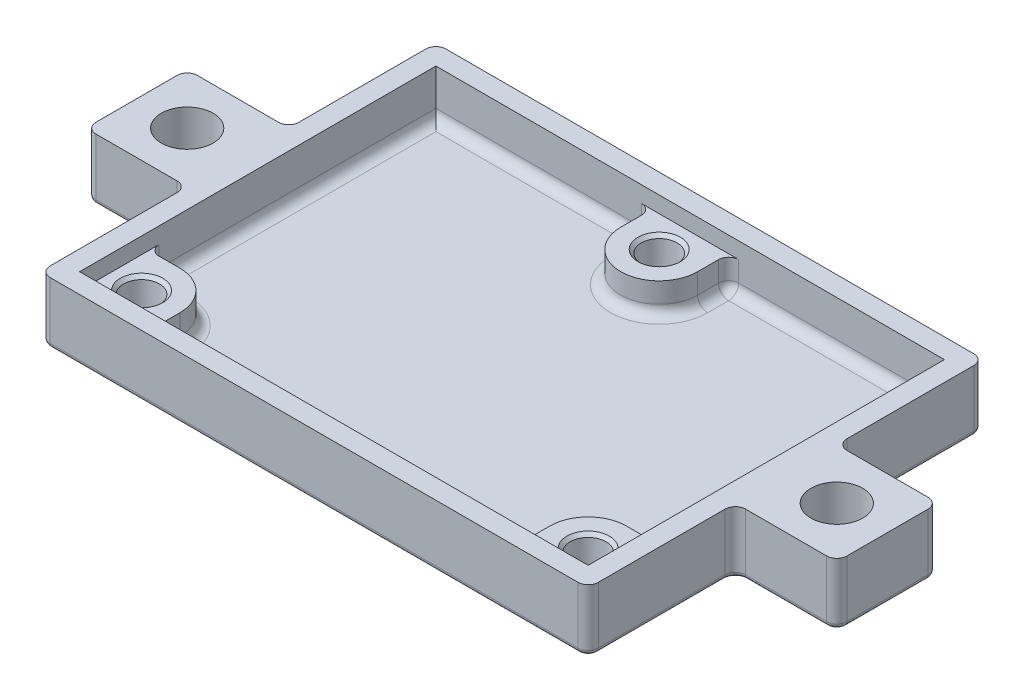
from build123d import *
from OCP.BRepFilletAPI import BRepFilletAPI_MakeChamfer

# Parameters (mm, degrees)
SKETCH1_W           = 54
SKETCH1_H           = 39
SKETCH1_W_2         = 10
SKETCH1_H_2         = 10
SKETCH1_R           = 2.5527
BOSS_EXTRUDE1_DEPTH = 6.1
SKETCH2_W           = 50.1
SKETCH2_H           = 35.1
CUT_EXTRUDE1_DEPTH  = 1.6
CUT_EXTRUDE2_DEPTH  = 3
SKETCH4_R           = 1.56
CUT_EXTRUDE3_DEPTH  = 43.065425233
SKETCH5_R           = 1.79
CUT_EXTRUDE4_DEPTH  = 2.92
DRAFT2_ANGLE        = 4
DRAFT3_ANGLE        = 4
DRAFT4_ANGLE        = 4
FILLET1_R           = 1
FILLET2_R           = 1
FILLET3_R           = 0.5
CHAMFER1_SIZE       = 0.3
CHAMFER1_SIZE2      = 0.323342908


with BuildPart() as part:
    # Sketch1 → Boss-Extrude1 (new body)
    # profile 1 of 3: a face of its own
    with BuildSketch(Plane(origin=(0, 0, 0), x_dir=(1, 0, 0), z_dir=(0, 1, 0))):
        Rectangle(SKETCH1_W, SKETCH1_H)
    # profile 2 of 3: a face of its own
    with BuildSketch(Plane(origin=(0, 0, 0), x_dir=(1, 0, 0), z_dir=(0, 1, 0))):
        with Locations((32, 0)):
            Rectangle(SKETCH1_W_2, SKETCH1_H_2)
        with Locations(Location((32, 0, 0), (0, 0, 270))):
            Circle(SKETCH1_R, mode=Mode.SUBTRACT)
    # profile 3 of 3: a face of its own
    with BuildSketch(Plane(origin=(0, 0, 0), x_dir=(1, 0, 0), z_dir=(0, 1, 0))):
        with Locations((-32, 0)):
            Rectangle(SKETCH1_W_2, SKETCH1_H_2)
        with Locations(Location((-32, 0, 0), (0, 0, 270))):
            Circle(SKETCH1_R, mode=Mode.SUBTRACT)
    extrude(amount=BOSS_EXTRUDE1_DEPTH)

    # Sketch2 → Cut-Extrude1 (cut)
    with BuildSketch(Plane(origin=(0, 6.1, 0), x_dir=(1, 0, 0), z_dir=(0, 1, 0))):
        Rectangle(SKETCH2_W, SKETCH2_H)
    extrude(amount=-CUT_EXTRUDE1_DEPTH, mode=Mode.SUBTRACT)

    # Sketch3 → Cut-Extrude2 (cut)
    with BuildSketch(Plane(origin=(0, 4.5, 0), x_dir=(1, 0, 0), z_dir=(0, 1, 0))):
        with BuildLine():
            Line((-3.79, 14.5), (-3.79, 17.55))
            Line((-3.79, 17.55), (-25.05, 17.55))
            Line((-25.05, 17.55), (-25.05, -10.71))
            Line((-25.05, -10.71), (-22, -10.71))
            ThreePointArc((-22, -10.71), (-19.320065299, -11.820065299), (-18.21, -14.5))
            Line((-18.21, -14.5), (-18.21, -17.55))
            Line((-18.21, -17.55), (18.21, -17.55))
            Line((18.21, -17.55), (18.21, -14.5))
            ThreePointArc((18.21, -14.5), (19.320065299, -11.820065299), (22, -10.71))
            Line((22, -10.71), (25.05, -10.71))
            Line((25.05, -10.71), (25.05, 17.55))
            Line((25.05, 17.55), (3.79, 17.55))
            Line((3.79, 17.55), (3.79, 14.5))
            ThreePointArc((3.79, 14.5), (0, 10.71), (-3.79, 14.5))
        make_face()
    extrude(amount=-CUT_EXTRUDE2_DEPTH, mode=Mode.SUBTRACT)

    # Sketch4 → Cut-Extrude3 (cut, through all)
    with BuildSketch(Plane(origin=(0, 4.5, 0), x_dir=(1, 0, 0), z_dir=(0, 1, 0))):
        with Locations(Location((0, 14.5, 0), (0, 0, 270))):
            Circle(SKETCH4_R)
        with Locations(Location((-22, -14.5, 0), (0, 0, 270))):
            Circle(SKETCH4_R)
        with Locations(Location((22, -14.5, 0), (0, 0, 90))):
            Circle(SKETCH4_R)
    extrude(amount=-CUT_EXTRUDE3_DEPTH, mode=Mode.SUBTRACT)

    # Sketch5 → Cut-Extrude4 (cut)
    with BuildSketch(Plane(origin=(0, 4.5, 0), x_dir=(1, 0, 0), z_dir=(0, 1, 0))):
        with Locations(Location((0, 14.5, 0), (0, 0, 270))):
            Circle(SKETCH5_R)
        with Locations(Location((-22, -14.5, 0), (0, 0, 270))):
            Circle(SKETCH5_R)
        with Locations(Location((22, -14.5, 0), (0, 0, 90))):
            Circle(SKETCH5_R)
    extrude(amount=-CUT_EXTRUDE4_DEPTH, mode=Mode.SUBTRACT)

    # Draft2
    draft2_faces = [part.faces().sort_by_distance(p)[0] for p in [
        (0, 3.04, -16.29),
    ]]
    draft(draft2_faces, Plane.ZX.offset(4.5), DRAFT2_ANGLE)

    # Draft3
    draft3_faces = [part.faces().sort_by_distance(p)[0] for p in [
        (-22, 3.04, 12.71),
    ]]
    draft(draft3_faces, Plane.ZX.offset(4.5), DRAFT3_ANGLE)

    # Draft4
    draft4_faces = [part.faces().sort_by_distance(p)[0] for p in [
        (22, 3.04, 16.29),
    ]]
    draft(draft4_faces, Plane.ZX.offset(4.5), DRAFT4_ANGLE)

    # Fillet1
    fillet1_edges = [part.edges().sort_by_distance(p)[0] for p in [
        (-27, 3.05, 19.5),
        (-27, 3.05, 5),
        (-37, 3.05, 5),
        (-37, 3.05, -5),
        (-27, 3.05, -5),
        (-27, 3.05, -19.5),
        (27, 3.05, -19.5),
        (27, 3.05, -5),
        (37, 3.05, -5),
        (37, 3.05, 5),
        (27, 3.05, 5),
        (27, 3.05, 19.5),
    ]]
    fillet(fillet1_edges, radius=FILLET1_R)

    # Fillet2
    fillet2_edges = [part.edges().sort_by_distance(p)[0] for p in [
        (0, 1.5, -10.71),
        (3.79, 1.5, -16.025),
        (14.42, 1.5, -17.55),
        (3.79, 3, -17.55),
        (25.05, 1.5, -3.42),
        (23.525, 1.5, 10.71),
        (25.05, 3, 10.71),
        (19.320065299, 1.5, 11.820065299),
        (18.21, 1.5, 16.025),
        (0, 1.5, 17.55),
        (18.21, 3, 17.55),
        (-18.21, 1.5, 16.025),
        (-18.21, 3, 17.55),
        (-19.320065299, 1.5, 11.820065299),
        (-23.525, 1.5, 10.71),
        (-25.05, 1.5, -3.42),
        (-25.05, 3, 10.71),
        (-14.42, 1.5, -17.55),
        (-3.79, 1.5, -16.025),
        (-3.79, 3, -17.55),
    ]]
    fillet(fillet2_edges, radius=FILLET2_R)

    # Fillet3
    fillet3_edges = [part.edges().sort_by_distance(p)[0] for p in [
        (-37, 0, 0),
        (0, 0, 19.5),
        (-27, 0, 12.25),
        (-32, 0, 5),
        (-32, 0, -5),
        (-27, 0, -12.25),
        (0, 0, -19.5),
        (27, 0, -12.25),
        (32, 0, -5),
        (37, 0, 0),
        (32, 0, 5),
        (27, 0, 12.25),
        (-36.707106781, 0, 4.707106781),
        (-26.707106781, 0, 19.207106781),
        (26.707106781, 0, 19.207106781),
        (36.707106781, 0, 4.707106781),
        (36.707106781, 0, -4.707106781),
        (26.707106781, 0, -19.207106781),
        (-26.707106781, 0, -19.207106781),
        (-36.707106781, 0, -4.707106781),
        (-27.292893219, 0, -5.292893219),
        (27.292893219, 0, -5.292893219),
        (27.292893219, 0, 5.292893219),
        (-27.292893219, 0, 5.292893219),
    ]]
    fillet(fillet3_edges, radius=FILLET3_R)

    # Chamfer1: one chamfer whose edges measure the first distance from different faces: ONE call of the kernel's chamfer builder (chamfer() names one face for all edges)
    chamfer1_edges_1 = [part.edges().sort_by_distance(p)[0] for p in [
        (0, 4.5, -16.29),
    ]]
    chamfer1_side_1 = [part.faces().sort_by_distance(p)[0] for p in [
        (3.672287639, 4.5, -15.525),
    ]]
    chamfer1_edges_2 = [part.edges().sort_by_distance(p)[0] for p in [
        (-22, 4.5, 12.71),
    ]]
    chamfer1_side_2 = [part.faces().sort_by_distance(p)[0] for p in [
        (-23.025, 4.5, 10.820874343),
    ]]
    chamfer1_edges_3 = [part.edges().sort_by_distance(p)[0] for p in [
        (22, 4.5, 16.29),
    ]]
    chamfer1_side_3 = [part.faces().sort_by_distance(p)[0] for p in [
        (18.320874343, 4.5, 15.525),
    ]]
    chamfer1 = BRepFilletAPI_MakeChamfer(part.part.solid().wrapped)
    for e in chamfer1_edges_1:
        chamfer1.Add(CHAMFER1_SIZE, CHAMFER1_SIZE2, e.wrapped, chamfer1_side_1[0].wrapped)  # the first distance lies on this face
    for e in chamfer1_edges_2:
        chamfer1.Add(CHAMFER1_SIZE, CHAMFER1_SIZE2, e.wrapped, chamfer1_side_2[0].wrapped)  # the first distance lies on this face
    for e in chamfer1_edges_3:
        chamfer1.Add(CHAMFER1_SIZE, CHAMFER1_SIZE2, e.wrapped, chamfer1_side_3[0].wrapped)  # the first distance lies on this face
    add(Compound.cast(chamfer1.Shape()), mode=Mode.REPLACE)


solid = part.part
